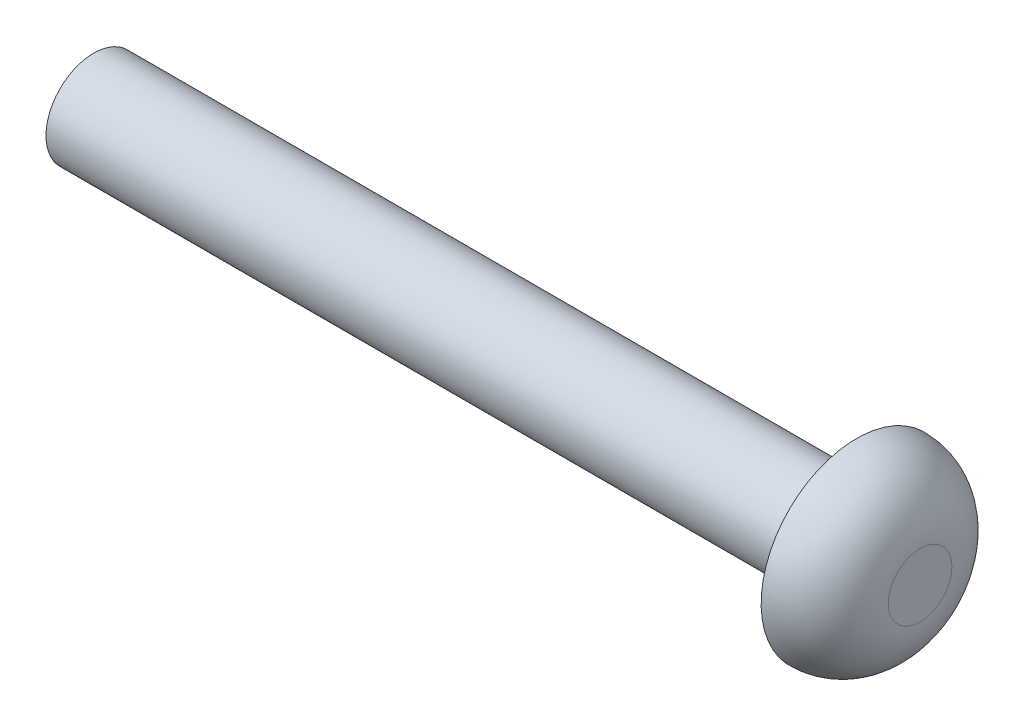
from build123d import *


with BuildPart() as part:
    # Sketch1 → Revolve1 (revolve)
    with BuildSketch(Plane.XY, mode=Mode.PRIVATE) as revolve1_sk:
        with BuildLine():
            Line((0, 0), (0, 6))
            Line((0, 6), (96, 6))
            Line((96, 6), (96, 12))
            ThreePointArc((96, 12), (101.656854249, 9.656854249), (104, 4))
            Line((104, 4), (104, 0))
            Line((104, 0), (0, 0))
        make_face()
    revolve(revolve1_sk.sketch.rotate(Axis((0, 0, 0), (1, 0, 0)), 180), axis=Axis((0, 0, 0), (1, 0, 0)))


solid = part.part
